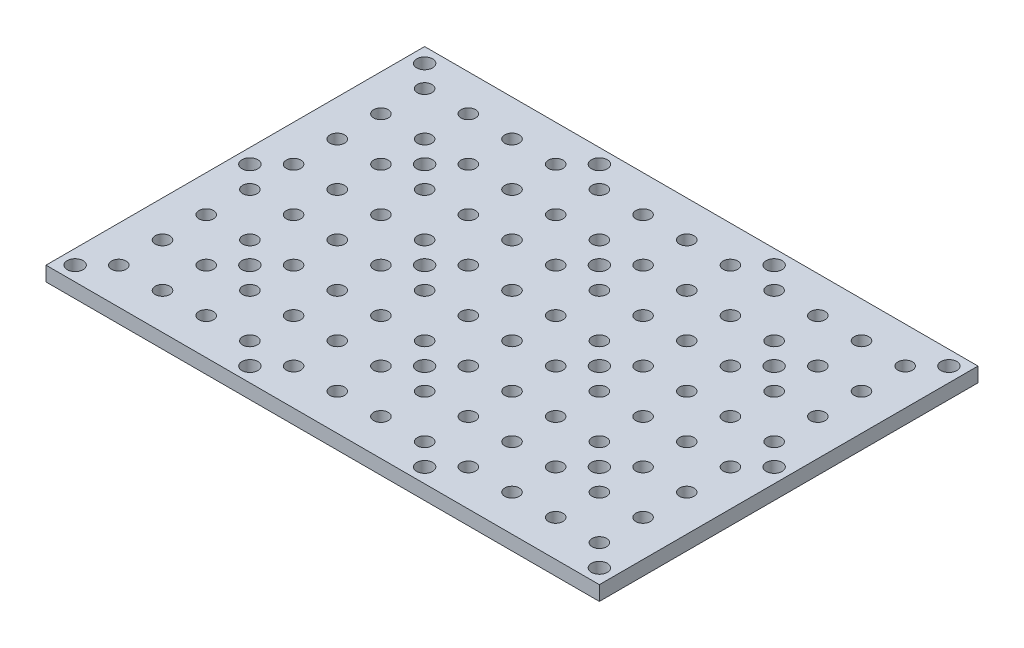
from build123d import *

# Parameters (mm, degrees)
SKETCH1_W                = 114
SKETCH1_H                = 78
BOSS_EXTRUDE1_DEPTH      = 3
SKETCH2_R                = 1.5
CUT_EXTRUDE2_DEPTH       = 70.130311731
LPATTERN1_COUNT          = 6
LPATTERN1_PITCH          = 9
LPATTERN1_COUNT_DIR2     = 4
LPATTERN1_PITCH_DIR2     = 9
MIRROR1_COPY_1_SKETCH_R  = 1.5
MIRROR1_COPY_1_DEPTH     = 70.130311731
MIRROR1_COPY_2_SKETCH_R  = 1.5
MIRROR1_COPY_2_DEPTH     = 70.130311731
MIRROR1_COPY_3_SKETCH_R  = 1.5
MIRROR1_COPY_3_DEPTH     = 70.130311731
MIRROR1_COPY_4_SKETCH_R  = 1.5
MIRROR1_COPY_4_DEPTH     = 70.130311731
MIRROR1_COPY_5_SKETCH_R  = 1.5
MIRROR1_COPY_5_DEPTH     = 70.130311731
MIRROR1_COPY_6_SKETCH_R  = 1.5
MIRROR1_COPY_6_DEPTH     = 70.130311731
MIRROR1_COPY_7_SKETCH_R  = 1.5
MIRROR1_COPY_7_DEPTH     = 70.130311731
MIRROR1_COPY_8_SKETCH_R  = 1.5
MIRROR1_COPY_8_DEPTH     = 70.130311731
MIRROR1_COPY_9_SKETCH_R  = 1.5
MIRROR1_COPY_9_DEPTH     = 70.130311731
MIRROR1_COPY_10_SKETCH_R = 1.5
MIRROR1_COPY_10_DEPTH    = 70.130311731
MIRROR1_COPY_11_SKETCH_R = 1.5
MIRROR1_COPY_11_DEPTH    = 70.130311731
MIRROR1_COPY_12_SKETCH_R = 1.5
MIRROR1_COPY_12_DEPTH    = 70.130311731
MIRROR1_COPY_13_SKETCH_R = 1.5
MIRROR1_COPY_13_DEPTH    = 70.130311731
MIRROR1_COPY_14_SKETCH_R = 1.5
MIRROR1_COPY_14_DEPTH    = 70.130311731
MIRROR1_COPY_15_SKETCH_R = 1.5
MIRROR1_COPY_15_DEPTH    = 70.130311731
MIRROR1_COPY_16_SKETCH_R = 1.5
MIRROR1_COPY_16_DEPTH    = 70.130311731
MIRROR1_COPY_17_SKETCH_R = 1.5
MIRROR1_COPY_17_DEPTH    = 70.130311731
MIRROR1_COPY_18_SKETCH_R = 1.5
MIRROR1_COPY_18_DEPTH    = 70.130311731
MIRROR1_COPY_19_SKETCH_R = 1.5
MIRROR1_COPY_19_DEPTH    = 70.130311731
MIRROR1_COPY_20_SKETCH_R = 1.5
MIRROR1_COPY_20_DEPTH    = 70.130311731
MIRROR1_COPY_21_SKETCH_R = 1.5
MIRROR1_COPY_21_DEPTH    = 70.130311731
MIRROR1_COPY_22_SKETCH_R = 1.5
MIRROR1_COPY_22_DEPTH    = 70.130311731
MIRROR1_COPY_23_SKETCH_R = 1.5
MIRROR1_COPY_23_DEPTH    = 70.130311731
MIRROR2_COPY_1_SKETCH_R  = 1.5
MIRROR2_COPY_1_DEPTH     = 70.130311731
MIRROR2_COPY_2_SKETCH_R  = 1.5
MIRROR2_COPY_2_DEPTH     = 70.130311731
MIRROR2_COPY_3_SKETCH_R  = 1.5
MIRROR2_COPY_3_DEPTH     = 70.130311731
MIRROR2_COPY_4_SKETCH_R  = 1.5
MIRROR2_COPY_4_DEPTH     = 70.130311731
MIRROR2_COPY_5_SKETCH_R  = 1.5
MIRROR2_COPY_5_DEPTH     = 70.130311731
MIRROR2_COPY_6_SKETCH_R  = 1.5
MIRROR2_COPY_6_DEPTH     = 70.130311731
MIRROR2_COPY_7_SKETCH_R  = 1.5
MIRROR2_COPY_7_DEPTH     = 70.130311731
MIRROR2_COPY_8_SKETCH_R  = 1.5
MIRROR2_COPY_8_DEPTH     = 70.130311731
MIRROR2_COPY_9_SKETCH_R  = 1.5
MIRROR2_COPY_9_DEPTH     = 70.130311731
MIRROR2_COPY_10_SKETCH_R = 1.5
MIRROR2_COPY_10_DEPTH    = 70.130311731
MIRROR2_COPY_11_SKETCH_R = 1.5
MIRROR2_COPY_11_DEPTH    = 70.130311731
MIRROR2_COPY_12_SKETCH_R = 1.5
MIRROR2_COPY_12_DEPTH    = 70.130311731
MIRROR2_COPY_13_SKETCH_R = 1.5
MIRROR2_COPY_13_DEPTH    = 70.130311731
MIRROR2_COPY_14_SKETCH_R = 1.5
MIRROR2_COPY_14_DEPTH    = 70.130311731
MIRROR2_COPY_15_SKETCH_R = 1.5
MIRROR2_COPY_15_DEPTH    = 70.130311731
MIRROR2_COPY_16_SKETCH_R = 1.5
MIRROR2_COPY_16_DEPTH    = 70.130311731
MIRROR2_COPY_17_SKETCH_R = 1.5
MIRROR2_COPY_17_DEPTH    = 70.130311731
MIRROR2_COPY_18_SKETCH_R = 1.5
MIRROR2_COPY_18_DEPTH    = 70.130311731
MIRROR2_COPY_19_SKETCH_R = 1.5
MIRROR2_COPY_19_DEPTH    = 70.130311731
MIRROR2_COPY_20_SKETCH_R = 1.5
MIRROR2_COPY_20_DEPTH    = 70.130311731
MIRROR2_COPY_21_SKETCH_R = 1.5
MIRROR2_COPY_21_DEPTH    = 70.130311731
MIRROR2_COPY_22_SKETCH_R = 1.5
MIRROR2_COPY_22_DEPTH    = 70.130311731
MIRROR2_COPY_23_SKETCH_R = 1.5
MIRROR2_COPY_23_DEPTH    = 70.130311731
MIRROR2_COPY_24_SKETCH_R = 1.5
MIRROR2_COPY_24_DEPTH    = 70.130311731
MIRROR2_COPY_25_SKETCH_R = 1.5
MIRROR2_COPY_25_DEPTH    = 70.130311731
MIRROR2_COPY_26_SKETCH_R = 1.5
MIRROR2_COPY_26_DEPTH    = 70.130311731
MIRROR2_COPY_27_SKETCH_R = 1.5
MIRROR2_COPY_27_DEPTH    = 70.130311731
MIRROR2_COPY_28_SKETCH_R = 1.5
MIRROR2_COPY_28_DEPTH    = 70.130311731
MIRROR2_COPY_29_SKETCH_R = 1.5
MIRROR2_COPY_29_DEPTH    = 70.130311731
MIRROR2_COPY_30_SKETCH_R = 1.5
MIRROR2_COPY_30_DEPTH    = 70.130311731
MIRROR2_COPY_31_SKETCH_R = 1.5
MIRROR2_COPY_31_DEPTH    = 70.130311731
MIRROR2_COPY_32_SKETCH_R = 1.5
MIRROR2_COPY_32_DEPTH    = 70.130311731
MIRROR2_COPY_33_SKETCH_R = 1.5
MIRROR2_COPY_33_DEPTH    = 70.130311731
MIRROR2_COPY_34_SKETCH_R = 1.5
MIRROR2_COPY_34_DEPTH    = 70.130311731
MIRROR2_COPY_35_SKETCH_R = 1.5
MIRROR2_COPY_35_DEPTH    = 70.130311731
MIRROR2_COPY_36_SKETCH_R = 1.5
MIRROR2_COPY_36_DEPTH    = 70.130311731
MIRROR2_COPY_37_SKETCH_R = 1.5
MIRROR2_COPY_37_DEPTH    = 70.130311731
MIRROR2_COPY_38_SKETCH_R = 1.5
MIRROR2_COPY_38_DEPTH    = 70.130311731
MIRROR2_COPY_39_SKETCH_R = 1.5
MIRROR2_COPY_39_DEPTH    = 70.130311731
MIRROR2_COPY_40_SKETCH_R = 1.5
MIRROR2_COPY_40_DEPTH    = 70.130311731
MIRROR2_COPY_41_SKETCH_R = 1.5
MIRROR2_COPY_41_DEPTH    = 70.130311731
MIRROR2_COPY_42_SKETCH_R = 1.5
MIRROR2_COPY_42_DEPTH    = 70.130311731
MIRROR2_COPY_43_SKETCH_R = 1.5
MIRROR2_COPY_43_DEPTH    = 70.130311731
MIRROR2_COPY_44_SKETCH_R = 1.5
MIRROR2_COPY_44_DEPTH    = 70.130311731
MIRROR2_COPY_45_SKETCH_R = 1.5
MIRROR2_COPY_45_DEPTH    = 70.130311731
MIRROR2_COPY_46_SKETCH_R = 1.5
MIRROR2_COPY_46_DEPTH    = 70.130311731
MIRROR2_COPY_47_SKETCH_R = 1.5
MIRROR2_COPY_47_DEPTH    = 70.130311731
F_4_CLEARANCE_HOLE1_D    = 3.2639


with BuildPart() as part:
    # Sketch1 → Boss-Extrude1 (new body)
    with BuildSketch(Plane(origin=(0, 0, 0), x_dir=(1, 0, 0), z_dir=(0, 1, 0))):
        Rectangle(SKETCH1_W, SKETCH1_H)
    extrude(amount=BOSS_EXTRUDE1_DEPTH)

    # Sketch2 → Cut-Extrude2 (cut, through all)
    with BuildSketch(Plane(origin=(0, 0, 0), x_dir=(1, 0, 0), z_dir=(0, 1, 0))):
        with Locations((-4.5, 4.5)):
            Circle(SKETCH2_R)
    cut_extrude2 = extrude(amount=CUT_EXTRUDE2_DEPTH, mode=Mode.SUBTRACT)

    # LPattern1: Cut-Extrude2 6 × 4
    with Locations(*[(-i * LPATTERN1_PITCH, 0, -j * LPATTERN1_PITCH_DIR2) for i in range(LPATTERN1_COUNT) for j in range(LPATTERN1_COUNT_DIR2) if (i, j) != (0, 0)]):
        add(cut_extrude2, mode=Mode.SUBTRACT)

    # Mirror1: Cut-Extrude2 across plane
    add(cut_extrude2.mirror(Plane.XY), mode=Mode.SUBTRACT)

    # Mirror1 copy 1 sketch → Mirror1 copy 1 (cut, through all)
    with BuildSketch(Plane(origin=(0, 0, 9), x_dir=(1, 0, 0), z_dir=(0, 1, 0))):
        with Locations((-4.5, -4.5)):
            Circle(MIRROR1_COPY_1_SKETCH_R)
    extrude(amount=MIRROR1_COPY_1_DEPTH, mode=Mode.SUBTRACT)

    # Mirror1 copy 2 sketch → Mirror1 copy 2 (cut, through all)
    with BuildSketch(Plane(origin=(0, 0, 18), x_dir=(1, 0, 0), z_dir=(0, 1, 0))):
        with Locations((-4.5, -4.5)):
            Circle(MIRROR1_COPY_2_SKETCH_R)
    extrude(amount=MIRROR1_COPY_2_DEPTH, mode=Mode.SUBTRACT)

    # Mirror1 copy 3 sketch → Mirror1 copy 3 (cut, through all)
    with BuildSketch(Plane(origin=(0, 0, 27), x_dir=(1, 0, 0), z_dir=(0, 1, 0))):
        with Locations((-4.5, -4.5)):
            Circle(MIRROR1_COPY_3_SKETCH_R)
    extrude(amount=MIRROR1_COPY_3_DEPTH, mode=Mode.SUBTRACT)

    # Mirror1 copy 4 sketch → Mirror1 copy 4 (cut, through all)
    with BuildSketch(Plane(origin=(-9, 0, 0), x_dir=(1, 0, 0), z_dir=(0, 1, 0))):
        with Locations((-4.5, -4.5)):
            Circle(MIRROR1_COPY_4_SKETCH_R)
    extrude(amount=MIRROR1_COPY_4_DEPTH, mode=Mode.SUBTRACT)

    # Mirror1 copy 5 sketch → Mirror1 copy 5 (cut, through all)
    with BuildSketch(Plane(origin=(-9, 0, 9), x_dir=(1, 0, 0), z_dir=(0, 1, 0))):
        with Locations((-4.5, -4.5)):
            Circle(MIRROR1_COPY_5_SKETCH_R)
    extrude(amount=MIRROR1_COPY_5_DEPTH, mode=Mode.SUBTRACT)

    # Mirror1 copy 6 sketch → Mirror1 copy 6 (cut, through all)
    with BuildSketch(Plane(origin=(-9, 0, 18), x_dir=(1, 0, 0), z_dir=(0, 1, 0))):
        with Locations((-4.5, -4.5)):
            Circle(MIRROR1_COPY_6_SKETCH_R)
    extrude(amount=MIRROR1_COPY_6_DEPTH, mode=Mode.SUBTRACT)

    # Mirror1 copy 7 sketch → Mirror1 copy 7 (cut, through all)
    with BuildSketch(Plane(origin=(-9, 0, 27), x_dir=(1, 0, 0), z_dir=(0, 1, 0))):
        with Locations((-4.5, -4.5)):
            Circle(MIRROR1_COPY_7_SKETCH_R)
    extrude(amount=MIRROR1_COPY_7_DEPTH, mode=Mode.SUBTRACT)

    # Mirror1 copy 8 sketch → Mirror1 copy 8 (cut, through all)
    with BuildSketch(Plane(origin=(-18, 0, 0), x_dir=(1, 0, 0), z_dir=(0, 1, 0))):
        with Locations((-4.5, -4.5)):
            Circle(MIRROR1_COPY_8_SKETCH_R)
    extrude(amount=MIRROR1_COPY_8_DEPTH, mode=Mode.SUBTRACT)

    # Mirror1 copy 9 sketch → Mirror1 copy 9 (cut, through all)
    with BuildSketch(Plane(origin=(-18, 0, 9), x_dir=(1, 0, 0), z_dir=(0, 1, 0))):
        with Locations((-4.5, -4.5)):
            Circle(MIRROR1_COPY_9_SKETCH_R)
    extrude(amount=MIRROR1_COPY_9_DEPTH, mode=Mode.SUBTRACT)

    # Mirror1 copy 10 sketch → Mirror1 copy 10 (cut, through all)
    with BuildSketch(Plane(origin=(-18, 0, 18), x_dir=(1, 0, 0), z_dir=(0, 1, 0))):
        with Locations((-4.5, -4.5)):
            Circle(MIRROR1_COPY_10_SKETCH_R)
    extrude(amount=MIRROR1_COPY_10_DEPTH, mode=Mode.SUBTRACT)

    # Mirror1 copy 11 sketch → Mirror1 copy 11 (cut, through all)
    with BuildSketch(Plane(origin=(-18, 0, 27), x_dir=(1, 0, 0), z_dir=(0, 1, 0))):
        with Locations((-4.5, -4.5)):
            Circle(MIRROR1_COPY_11_SKETCH_R)
    extrude(amount=MIRROR1_COPY_11_DEPTH, mode=Mode.SUBTRACT)

    # Mirror1 copy 12 sketch → Mirror1 copy 12 (cut, through all)
    with BuildSketch(Plane(origin=(-27, 0, 0), x_dir=(1, 0, 0), z_dir=(0, 1, 0))):
        with Locations((-4.5, -4.5)):
            Circle(MIRROR1_COPY_12_SKETCH_R)
    extrude(amount=MIRROR1_COPY_12_DEPTH, mode=Mode.SUBTRACT)

    # Mirror1 copy 13 sketch → Mirror1 copy 13 (cut, through all)
    with BuildSketch(Plane(origin=(-27, 0, 9), x_dir=(1, 0, 0), z_dir=(0, 1, 0))):
        with Locations((-4.5, -4.5)):
            Circle(MIRROR1_COPY_13_SKETCH_R)
    extrude(amount=MIRROR1_COPY_13_DEPTH, mode=Mode.SUBTRACT)

    # Mirror1 copy 14 sketch → Mirror1 copy 14 (cut, through all)
    with BuildSketch(Plane(origin=(-27, 0, 18), x_dir=(1, 0, 0), z_dir=(0, 1, 0))):
        with Locations((-4.5, -4.5)):
            Circle(MIRROR1_COPY_14_SKETCH_R)
    extrude(amount=MIRROR1_COPY_14_DEPTH, mode=Mode.SUBTRACT)

    # Mirror1 copy 15 sketch → Mirror1 copy 15 (cut, through all)
    with BuildSketch(Plane(origin=(-27, 0, 27), x_dir=(1, 0, 0), z_dir=(0, 1, 0))):
        with Locations((-4.5, -4.5)):
            Circle(MIRROR1_COPY_15_SKETCH_R)
    extrude(amount=MIRROR1_COPY_15_DEPTH, mode=Mode.SUBTRACT)

    # Mirror1 copy 16 sketch → Mirror1 copy 16 (cut, through all)
    with BuildSketch(Plane(origin=(-36, 0, 0), x_dir=(1, 0, 0), z_dir=(0, 1, 0))):
        with Locations((-4.5, -4.5)):
            Circle(MIRROR1_COPY_16_SKETCH_R)
    extrude(amount=MIRROR1_COPY_16_DEPTH, mode=Mode.SUBTRACT)

    # Mirror1 copy 17 sketch → Mirror1 copy 17 (cut, through all)
    with BuildSketch(Plane(origin=(-36, 0, 9), x_dir=(1, 0, 0), z_dir=(0, 1, 0))):
        with Locations((-4.5, -4.5)):
            Circle(MIRROR1_COPY_17_SKETCH_R)
    extrude(amount=MIRROR1_COPY_17_DEPTH, mode=Mode.SUBTRACT)

    # Mirror1 copy 18 sketch → Mirror1 copy 18 (cut, through all)
    with BuildSketch(Plane(origin=(-36, 0, 18), x_dir=(1, 0, 0), z_dir=(0, 1, 0))):
        with Locations((-4.5, -4.5)):
            Circle(MIRROR1_COPY_18_SKETCH_R)
    extrude(amount=MIRROR1_COPY_18_DEPTH, mode=Mode.SUBTRACT)

    # Mirror1 copy 19 sketch → Mirror1 copy 19 (cut, through all)
    with BuildSketch(Plane(origin=(-36, 0, 27), x_dir=(1, 0, 0), z_dir=(0, 1, 0))):
        with Locations((-4.5, -4.5)):
            Circle(MIRROR1_COPY_19_SKETCH_R)
    extrude(amount=MIRROR1_COPY_19_DEPTH, mode=Mode.SUBTRACT)

    # Mirror1 copy 20 sketch → Mirror1 copy 20 (cut, through all)
    with BuildSketch(Plane(origin=(-45, 0, 0), x_dir=(1, 0, 0), z_dir=(0, 1, 0))):
        with Locations((-4.5, -4.5)):
            Circle(MIRROR1_COPY_20_SKETCH_R)
    extrude(amount=MIRROR1_COPY_20_DEPTH, mode=Mode.SUBTRACT)

    # Mirror1 copy 21 sketch → Mirror1 copy 21 (cut, through all)
    with BuildSketch(Plane(origin=(-45, 0, 9), x_dir=(1, 0, 0), z_dir=(0, 1, 0))):
        with Locations((-4.5, -4.5)):
            Circle(MIRROR1_COPY_21_SKETCH_R)
    extrude(amount=MIRROR1_COPY_21_DEPTH, mode=Mode.SUBTRACT)

    # Mirror1 copy 22 sketch → Mirror1 copy 22 (cut, through all)
    with BuildSketch(Plane(origin=(-45, 0, 18), x_dir=(1, 0, 0), z_dir=(0, 1, 0))):
        with Locations((-4.5, -4.5)):
            Circle(MIRROR1_COPY_22_SKETCH_R)
    extrude(amount=MIRROR1_COPY_22_DEPTH, mode=Mode.SUBTRACT)

    # Mirror1 copy 23 sketch → Mirror1 copy 23 (cut, through all)
    with BuildSketch(Plane(origin=(-45, 0, 27), x_dir=(1, 0, 0), z_dir=(0, 1, 0))):
        with Locations((-4.5, -4.5)):
            Circle(MIRROR1_COPY_23_SKETCH_R)
    extrude(amount=MIRROR1_COPY_23_DEPTH, mode=Mode.SUBTRACT)

    # Mirror2: Cut-Extrude2 across plane
    add(cut_extrude2.mirror(Plane(origin=(0, 0, 0), x_dir=(0, 0, 1), z_dir=(1, 0, 0))), mode=Mode.SUBTRACT)

    # Mirror2 copy 1 sketch → Mirror2 copy 1 (cut, through all)
    with BuildSketch(Plane(origin=(0, 0, -9), x_dir=(-1, 0, 0), z_dir=(0, 1, 0))):
        with Locations((-4.5, -4.5)):
            Circle(MIRROR2_COPY_1_SKETCH_R)
    extrude(amount=MIRROR2_COPY_1_DEPTH, mode=Mode.SUBTRACT)

    # Mirror2 copy 2 sketch → Mirror2 copy 2 (cut, through all)
    with BuildSketch(Plane(origin=(0, 0, -18), x_dir=(-1, 0, 0), z_dir=(0, 1, 0))):
        with Locations((-4.5, -4.5)):
            Circle(MIRROR2_COPY_2_SKETCH_R)
    extrude(amount=MIRROR2_COPY_2_DEPTH, mode=Mode.SUBTRACT)

    # Mirror2 copy 3 sketch → Mirror2 copy 3 (cut, through all)
    with BuildSketch(Plane(origin=(0, 0, -27), x_dir=(-1, 0, 0), z_dir=(0, 1, 0))):
        with Locations((-4.5, -4.5)):
            Circle(MIRROR2_COPY_3_SKETCH_R)
    extrude(amount=MIRROR2_COPY_3_DEPTH, mode=Mode.SUBTRACT)

    # Mirror2 copy 4 sketch → Mirror2 copy 4 (cut, through all)
    with BuildSketch(Plane(origin=(9, 0, 0), x_dir=(-1, 0, 0), z_dir=(0, 1, 0))):
        with Locations((-4.5, -4.5)):
            Circle(MIRROR2_COPY_4_SKETCH_R)
    extrude(amount=MIRROR2_COPY_4_DEPTH, mode=Mode.SUBTRACT)

    # Mirror2 copy 5 sketch → Mirror2 copy 5 (cut, through all)
    with BuildSketch(Plane(origin=(9, 0, -9), x_dir=(-1, 0, 0), z_dir=(0, 1, 0))):
        with Locations((-4.5, -4.5)):
            Circle(MIRROR2_COPY_5_SKETCH_R)
    extrude(amount=MIRROR2_COPY_5_DEPTH, mode=Mode.SUBTRACT)

    # Mirror2 copy 6 sketch → Mirror2 copy 6 (cut, through all)
    with BuildSketch(Plane(origin=(9, 0, -18), x_dir=(-1, 0, 0), z_dir=(0, 1, 0))):
        with Locations((-4.5, -4.5)):
            Circle(MIRROR2_COPY_6_SKETCH_R)
    extrude(amount=MIRROR2_COPY_6_DEPTH, mode=Mode.SUBTRACT)

    # Mirror2 copy 7 sketch → Mirror2 copy 7 (cut, through all)
    with BuildSketch(Plane(origin=(9, 0, -27), x_dir=(-1, 0, 0), z_dir=(0, 1, 0))):
        with Locations((-4.5, -4.5)):
            Circle(MIRROR2_COPY_7_SKETCH_R)
    extrude(amount=MIRROR2_COPY_7_DEPTH, mode=Mode.SUBTRACT)

    # Mirror2 copy 8 sketch → Mirror2 copy 8 (cut, through all)
    with BuildSketch(Plane(origin=(18, 0, 0), x_dir=(-1, 0, 0), z_dir=(0, 1, 0))):
        with Locations((-4.5, -4.5)):
            Circle(MIRROR2_COPY_8_SKETCH_R)
    extrude(amount=MIRROR2_COPY_8_DEPTH, mode=Mode.SUBTRACT)

    # Mirror2 copy 9 sketch → Mirror2 copy 9 (cut, through all)
    with BuildSketch(Plane(origin=(18, 0, -9), x_dir=(-1, 0, 0), z_dir=(0, 1, 0))):
        with Locations((-4.5, -4.5)):
            Circle(MIRROR2_COPY_9_SKETCH_R)
    extrude(amount=MIRROR2_COPY_9_DEPTH, mode=Mode.SUBTRACT)

    # Mirror2 copy 10 sketch → Mirror2 copy 10 (cut, through all)
    with BuildSketch(Plane(origin=(18, 0, -18), x_dir=(-1, 0, 0), z_dir=(0, 1, 0))):
        with Locations((-4.5, -4.5)):
            Circle(MIRROR2_COPY_10_SKETCH_R)
    extrude(amount=MIRROR2_COPY_10_DEPTH, mode=Mode.SUBTRACT)

    # Mirror2 copy 11 sketch → Mirror2 copy 11 (cut, through all)
    with BuildSketch(Plane(origin=(18, 0, -27), x_dir=(-1, 0, 0), z_dir=(0, 1, 0))):
        with Locations((-4.5, -4.5)):
            Circle(MIRROR2_COPY_11_SKETCH_R)
    extrude(amount=MIRROR2_COPY_11_DEPTH, mode=Mode.SUBTRACT)

    # Mirror2 copy 12 sketch → Mirror2 copy 12 (cut, through all)
    with BuildSketch(Plane(origin=(27, 0, 0), x_dir=(-1, 0, 0), z_dir=(0, 1, 0))):
        with Locations((-4.5, -4.5)):
            Circle(MIRROR2_COPY_12_SKETCH_R)
    extrude(amount=MIRROR2_COPY_12_DEPTH, mode=Mode.SUBTRACT)

    # Mirror2 copy 13 sketch → Mirror2 copy 13 (cut, through all)
    with BuildSketch(Plane(origin=(27, 0, -9), x_dir=(-1, 0, 0), z_dir=(0, 1, 0))):
        with Locations((-4.5, -4.5)):
            Circle(MIRROR2_COPY_13_SKETCH_R)
    extrude(amount=MIRROR2_COPY_13_DEPTH, mode=Mode.SUBTRACT)

    # Mirror2 copy 14 sketch → Mirror2 copy 14 (cut, through all)
    with BuildSketch(Plane(origin=(27, 0, -18), x_dir=(-1, 0, 0), z_dir=(0, 1, 0))):
        with Locations((-4.5, -4.5)):
            Circle(MIRROR2_COPY_14_SKETCH_R)
    extrude(amount=MIRROR2_COPY_14_DEPTH, mode=Mode.SUBTRACT)

    # Mirror2 copy 15 sketch → Mirror2 copy 15 (cut, through all)
    with BuildSketch(Plane(origin=(27, 0, -27), x_dir=(-1, 0, 0), z_dir=(0, 1, 0))):
        with Locations((-4.5, -4.5)):
            Circle(MIRROR2_COPY_15_SKETCH_R)
    extrude(amount=MIRROR2_COPY_15_DEPTH, mode=Mode.SUBTRACT)

    # Mirror2 copy 16 sketch → Mirror2 copy 16 (cut, through all)
    with BuildSketch(Plane(origin=(36, 0, 0), x_dir=(-1, 0, 0), z_dir=(0, 1, 0))):
        with Locations((-4.5, -4.5)):
            Circle(MIRROR2_COPY_16_SKETCH_R)
    extrude(amount=MIRROR2_COPY_16_DEPTH, mode=Mode.SUBTRACT)

    # Mirror2 copy 17 sketch → Mirror2 copy 17 (cut, through all)
    with BuildSketch(Plane(origin=(36, 0, -9), x_dir=(-1, 0, 0), z_dir=(0, 1, 0))):
        with Locations((-4.5, -4.5)):
            Circle(MIRROR2_COPY_17_SKETCH_R)
    extrude(amount=MIRROR2_COPY_17_DEPTH, mode=Mode.SUBTRACT)

    # Mirror2 copy 18 sketch → Mirror2 copy 18 (cut, through all)
    with BuildSketch(Plane(origin=(36, 0, -18), x_dir=(-1, 0, 0), z_dir=(0, 1, 0))):
        with Locations((-4.5, -4.5)):
            Circle(MIRROR2_COPY_18_SKETCH_R)
    extrude(amount=MIRROR2_COPY_18_DEPTH, mode=Mode.SUBTRACT)

    # Mirror2 copy 19 sketch → Mirror2 copy 19 (cut, through all)
    with BuildSketch(Plane(origin=(36, 0, -27), x_dir=(-1, 0, 0), z_dir=(0, 1, 0))):
        with Locations((-4.5, -4.5)):
            Circle(MIRROR2_COPY_19_SKETCH_R)
    extrude(amount=MIRROR2_COPY_19_DEPTH, mode=Mode.SUBTRACT)

    # Mirror2 copy 20 sketch → Mirror2 copy 20 (cut, through all)
    with BuildSketch(Plane(origin=(45, 0, 0), x_dir=(-1, 0, 0), z_dir=(0, 1, 0))):
        with Locations((-4.5, -4.5)):
            Circle(MIRROR2_COPY_20_SKETCH_R)
    extrude(amount=MIRROR2_COPY_20_DEPTH, mode=Mode.SUBTRACT)

    # Mirror2 copy 21 sketch → Mirror2 copy 21 (cut, through all)
    with BuildSketch(Plane(origin=(45, 0, -9), x_dir=(-1, 0, 0), z_dir=(0, 1, 0))):
        with Locations((-4.5, -4.5)):
            Circle(MIRROR2_COPY_21_SKETCH_R)
    extrude(amount=MIRROR2_COPY_21_DEPTH, mode=Mode.SUBTRACT)

    # Mirror2 copy 22 sketch → Mirror2 copy 22 (cut, through all)
    with BuildSketch(Plane(origin=(45, 0, -18), x_dir=(-1, 0, 0), z_dir=(0, 1, 0))):
        with Locations((-4.5, -4.5)):
            Circle(MIRROR2_COPY_22_SKETCH_R)
    extrude(amount=MIRROR2_COPY_22_DEPTH, mode=Mode.SUBTRACT)

    # Mirror2 copy 23 sketch → Mirror2 copy 23 (cut, through all)
    with BuildSketch(Plane(origin=(45, 0, -27), x_dir=(-1, 0, 0), z_dir=(0, 1, 0))):
        with Locations((-4.5, -4.5)):
            Circle(MIRROR2_COPY_23_SKETCH_R)
    extrude(amount=MIRROR2_COPY_23_DEPTH, mode=Mode.SUBTRACT)

    # Mirror2 copy 24 sketch → Mirror2 copy 24 (cut, through all)
    with BuildSketch(Plane(origin=(0, 0, 0), x_dir=(-1, 0, 0), z_dir=(0, 1, 0))):
        with Locations((-4.5, 4.5)):
            Circle(MIRROR2_COPY_24_SKETCH_R)
    extrude(amount=MIRROR2_COPY_24_DEPTH, mode=Mode.SUBTRACT)

    # Mirror2 copy 25 sketch → Mirror2 copy 25 (cut, through all)
    with BuildSketch(Plane(origin=(0, 0, 9), x_dir=(-1, 0, 0), z_dir=(0, 1, 0))):
        with Locations((-4.5, 4.5)):
            Circle(MIRROR2_COPY_25_SKETCH_R)
    extrude(amount=MIRROR2_COPY_25_DEPTH, mode=Mode.SUBTRACT)

    # Mirror2 copy 26 sketch → Mirror2 copy 26 (cut, through all)
    with BuildSketch(Plane(origin=(0, 0, 18), x_dir=(-1, 0, 0), z_dir=(0, 1, 0))):
        with Locations((-4.5, 4.5)):
            Circle(MIRROR2_COPY_26_SKETCH_R)
    extrude(amount=MIRROR2_COPY_26_DEPTH, mode=Mode.SUBTRACT)

    # Mirror2 copy 27 sketch → Mirror2 copy 27 (cut, through all)
    with BuildSketch(Plane(origin=(0, 0, 27), x_dir=(-1, 0, 0), z_dir=(0, 1, 0))):
        with Locations((-4.5, 4.5)):
            Circle(MIRROR2_COPY_27_SKETCH_R)
    extrude(amount=MIRROR2_COPY_27_DEPTH, mode=Mode.SUBTRACT)

    # Mirror2 copy 28 sketch → Mirror2 copy 28 (cut, through all)
    with BuildSketch(Plane(origin=(9, 0, 0), x_dir=(-1, 0, 0), z_dir=(0, 1, 0))):
        with Locations((-4.5, 4.5)):
            Circle(MIRROR2_COPY_28_SKETCH_R)
    extrude(amount=MIRROR2_COPY_28_DEPTH, mode=Mode.SUBTRACT)

    # Mirror2 copy 29 sketch → Mirror2 copy 29 (cut, through all)
    with BuildSketch(Plane(origin=(9, 0, 9), x_dir=(-1, 0, 0), z_dir=(0, 1, 0))):
        with Locations((-4.5, 4.5)):
            Circle(MIRROR2_COPY_29_SKETCH_R)
    extrude(amount=MIRROR2_COPY_29_DEPTH, mode=Mode.SUBTRACT)

    # Mirror2 copy 30 sketch → Mirror2 copy 30 (cut, through all)
    with BuildSketch(Plane(origin=(9, 0, 18), x_dir=(-1, 0, 0), z_dir=(0, 1, 0))):
        with Locations((-4.5, 4.5)):
            Circle(MIRROR2_COPY_30_SKETCH_R)
    extrude(amount=MIRROR2_COPY_30_DEPTH, mode=Mode.SUBTRACT)

    # Mirror2 copy 31 sketch → Mirror2 copy 31 (cut, through all)
    with BuildSketch(Plane(origin=(9, 0, 27), x_dir=(-1, 0, 0), z_dir=(0, 1, 0))):
        with Locations((-4.5, 4.5)):
            Circle(MIRROR2_COPY_31_SKETCH_R)
    extrude(amount=MIRROR2_COPY_31_DEPTH, mode=Mode.SUBTRACT)

    # Mirror2 copy 32 sketch → Mirror2 copy 32 (cut, through all)
    with BuildSketch(Plane(origin=(18, 0, 0), x_dir=(-1, 0, 0), z_dir=(0, 1, 0))):
        with Locations((-4.5, 4.5)):
            Circle(MIRROR2_COPY_32_SKETCH_R)
    extrude(amount=MIRROR2_COPY_32_DEPTH, mode=Mode.SUBTRACT)

    # Mirror2 copy 33 sketch → Mirror2 copy 33 (cut, through all)
    with BuildSketch(Plane(origin=(18, 0, 9), x_dir=(-1, 0, 0), z_dir=(0, 1, 0))):
        with Locations((-4.5, 4.5)):
            Circle(MIRROR2_COPY_33_SKETCH_R)
    extrude(amount=MIRROR2_COPY_33_DEPTH, mode=Mode.SUBTRACT)

    # Mirror2 copy 34 sketch → Mirror2 copy 34 (cut, through all)
    with BuildSketch(Plane(origin=(18, 0, 18), x_dir=(-1, 0, 0), z_dir=(0, 1, 0))):
        with Locations((-4.5, 4.5)):
            Circle(MIRROR2_COPY_34_SKETCH_R)
    extrude(amount=MIRROR2_COPY_34_DEPTH, mode=Mode.SUBTRACT)

    # Mirror2 copy 35 sketch → Mirror2 copy 35 (cut, through all)
    with BuildSketch(Plane(origin=(18, 0, 27), x_dir=(-1, 0, 0), z_dir=(0, 1, 0))):
        with Locations((-4.5, 4.5)):
            Circle(MIRROR2_COPY_35_SKETCH_R)
    extrude(amount=MIRROR2_COPY_35_DEPTH, mode=Mode.SUBTRACT)

    # Mirror2 copy 36 sketch → Mirror2 copy 36 (cut, through all)
    with BuildSketch(Plane(origin=(27, 0, 0), x_dir=(-1, 0, 0), z_dir=(0, 1, 0))):
        with Locations((-4.5, 4.5)):
            Circle(MIRROR2_COPY_36_SKETCH_R)
    extrude(amount=MIRROR2_COPY_36_DEPTH, mode=Mode.SUBTRACT)

    # Mirror2 copy 37 sketch → Mirror2 copy 37 (cut, through all)
    with BuildSketch(Plane(origin=(27, 0, 9), x_dir=(-1, 0, 0), z_dir=(0, 1, 0))):
        with Locations((-4.5, 4.5)):
            Circle(MIRROR2_COPY_37_SKETCH_R)
    extrude(amount=MIRROR2_COPY_37_DEPTH, mode=Mode.SUBTRACT)

    # Mirror2 copy 38 sketch → Mirror2 copy 38 (cut, through all)
    with BuildSketch(Plane(origin=(27, 0, 18), x_dir=(-1, 0, 0), z_dir=(0, 1, 0))):
        with Locations((-4.5, 4.5)):
            Circle(MIRROR2_COPY_38_SKETCH_R)
    extrude(amount=MIRROR2_COPY_38_DEPTH, mode=Mode.SUBTRACT)

    # Mirror2 copy 39 sketch → Mirror2 copy 39 (cut, through all)
    with BuildSketch(Plane(origin=(27, 0, 27), x_dir=(-1, 0, 0), z_dir=(0, 1, 0))):
        with Locations((-4.5, 4.5)):
            Circle(MIRROR2_COPY_39_SKETCH_R)
    extrude(amount=MIRROR2_COPY_39_DEPTH, mode=Mode.SUBTRACT)

    # Mirror2 copy 40 sketch → Mirror2 copy 40 (cut, through all)
    with BuildSketch(Plane(origin=(36, 0, 0), x_dir=(-1, 0, 0), z_dir=(0, 1, 0))):
        with Locations((-4.5, 4.5)):
            Circle(MIRROR2_COPY_40_SKETCH_R)
    extrude(amount=MIRROR2_COPY_40_DEPTH, mode=Mode.SUBTRACT)

    # Mirror2 copy 41 sketch → Mirror2 copy 41 (cut, through all)
    with BuildSketch(Plane(origin=(36, 0, 9), x_dir=(-1, 0, 0), z_dir=(0, 1, 0))):
        with Locations((-4.5, 4.5)):
            Circle(MIRROR2_COPY_41_SKETCH_R)
    extrude(amount=MIRROR2_COPY_41_DEPTH, mode=Mode.SUBTRACT)

    # Mirror2 copy 42 sketch → Mirror2 copy 42 (cut, through all)
    with BuildSketch(Plane(origin=(36, 0, 18), x_dir=(-1, 0, 0), z_dir=(0, 1, 0))):
        with Locations((-4.5, 4.5)):
            Circle(MIRROR2_COPY_42_SKETCH_R)
    extrude(amount=MIRROR2_COPY_42_DEPTH, mode=Mode.SUBTRACT)

    # Mirror2 copy 43 sketch → Mirror2 copy 43 (cut, through all)
    with BuildSketch(Plane(origin=(36, 0, 27), x_dir=(-1, 0, 0), z_dir=(0, 1, 0))):
        with Locations((-4.5, 4.5)):
            Circle(MIRROR2_COPY_43_SKETCH_R)
    extrude(amount=MIRROR2_COPY_43_DEPTH, mode=Mode.SUBTRACT)

    # Mirror2 copy 44 sketch → Mirror2 copy 44 (cut, through all)
    with BuildSketch(Plane(origin=(45, 0, 0), x_dir=(-1, 0, 0), z_dir=(0, 1, 0))):
        with Locations((-4.5, 4.5)):
            Circle(MIRROR2_COPY_44_SKETCH_R)
    extrude(amount=MIRROR2_COPY_44_DEPTH, mode=Mode.SUBTRACT)

    # Mirror2 copy 45 sketch → Mirror2 copy 45 (cut, through all)
    with BuildSketch(Plane(origin=(45, 0, 9), x_dir=(-1, 0, 0), z_dir=(0, 1, 0))):
        with Locations((-4.5, 4.5)):
            Circle(MIRROR2_COPY_45_SKETCH_R)
    extrude(amount=MIRROR2_COPY_45_DEPTH, mode=Mode.SUBTRACT)

    # Mirror2 copy 46 sketch → Mirror2 copy 46 (cut, through all)
    with BuildSketch(Plane(origin=(45, 0, 18), x_dir=(-1, 0, 0), z_dir=(0, 1, 0))):
        with Locations((-4.5, 4.5)):
            Circle(MIRROR2_COPY_46_SKETCH_R)
    extrude(amount=MIRROR2_COPY_46_DEPTH, mode=Mode.SUBTRACT)

    # Mirror2 copy 47 sketch → Mirror2 copy 47 (cut, through all)
    with BuildSketch(Plane(origin=(45, 0, 27), x_dir=(-1, 0, 0), z_dir=(0, 1, 0))):
        with Locations((-4.5, 4.5)):
            Circle(MIRROR2_COPY_47_SKETCH_R)
    extrude(amount=MIRROR2_COPY_47_DEPTH, mode=Mode.SUBTRACT)

    # #4 Clearance Hole1 (through all)
    with Locations(Plane(origin=(0, 3, 0), x_dir=(1, 0, 0), z_dir=(0, 1, 0))):
        with Locations((-36, 18), (36, -18), (36, 18), (-36, -18), (0, 18), (0, -18), (-54, 36), (-18, 36), (18, 36), (54, 36), (54, 0), (18, 0), (-18, 0), (-54, 0), (-54, -36), (-18, -36), (18, -36), (54, -36)):
            Hole(F_4_CLEARANCE_HOLE1_D / 2)


solid = part.part
